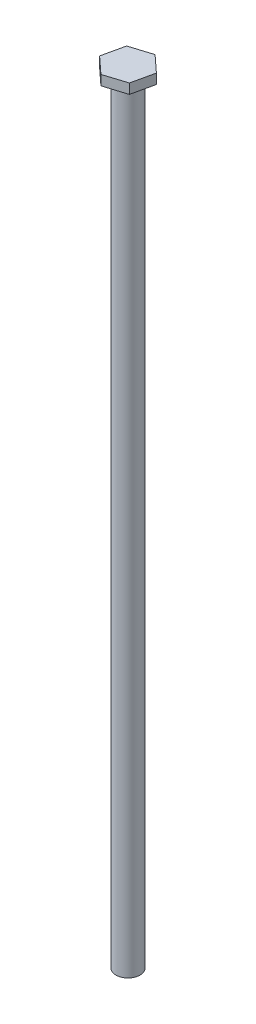
from build123d import *

# Parameters (mm, degrees)
BOSS_EXTRUDE3_DEPTH      = 4
BOSS_EXTRUDE3_DEPTH_BACK = 50
SKETCH2_R                = 0.611392816
BOSS_EXTRUDE4_DEPTH      = 0.5
SKETCH4_W                = 4.000836521
SKETCH4_H                = 3.633574568
CUT_EXTRUDE1_DEPTH       = 15


with BuildPart() as part:
    # Sketch2 → Boss-Extrude3 (new, two sides: drawn at the far end of the back side and taken through both)
    with BuildSketch(Plane(origin=(0, 0, 0), x_dir=(1, 0, 0), z_dir=(0, 1, 0)).offset(-BOSS_EXTRUDE3_DEPTH_BACK)):
        with Locations(Location((0, 0, 0), (0, 0, 270))):
            Circle(SKETCH2_R)
    extrude(amount=BOSS_EXTRUDE3_DEPTH + BOSS_EXTRUDE3_DEPTH_BACK)

    # Sketch3 → Boss-Extrude4 (add)
    with BuildSketch(Plane(origin=(0, 4, 0), x_dir=(1, 0, 0), z_dir=(0, 1, 0))):
        Polygon((0.842464754, -0.774154905), (1.091670191, 0.342518427), (0.249205437, 1.116673331), (-0.842464754, 0.774154905), (-1.091670191, -0.342518427), (-0.249205437, -1.116673331), align=None)
    extrude(amount=BOSS_EXTRUDE4_DEPTH)

    # Sketch4 → Cut-Extrude1 (cut)
    with BuildSketch(Plane(origin=(0, -50, 0), x_dir=(-1, 0, 0), z_dir=(0, -1, 0))):
        with Locations((-0.863813315, -0.094243853)):
            Rectangle(SKETCH4_W, SKETCH4_H)
    extrude(amount=-CUT_EXTRUDE1_DEPTH, mode=Mode.SUBTRACT)


solid = part.part
